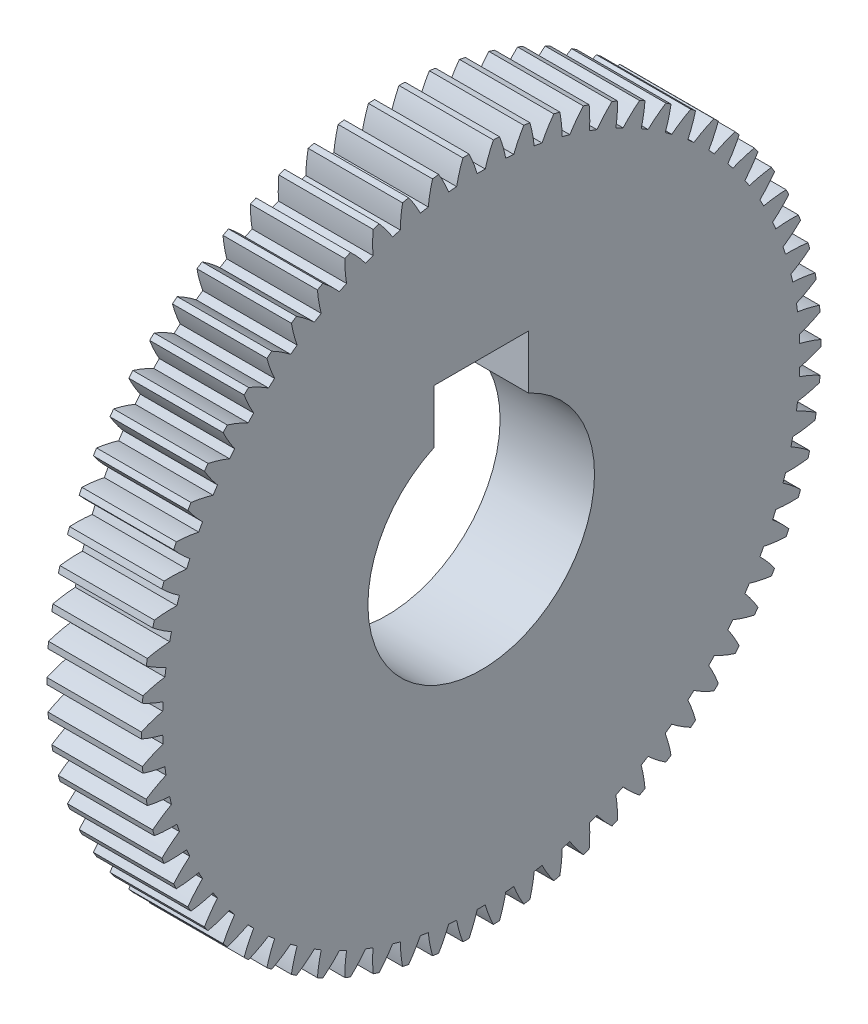
from build123d import *

# Parameters (mm, degrees)
BASPROSKE_W     = 5
BASPROSKE_H     = 18
TOOTHCUT_DEPTH  = 26.942243542
TEETHCUTS_COUNT = 70
TEETHCUTS_ANGLE = 354.857142857
BORSKE_R        = 6
BORE_DEPTH      = 50.0000508
KEYSKE_W        = 5
KEYSKE_H        = 8.3
KEYWAY_DEPTH    = 50.0000508


with BuildPart() as part:
    # BasProSke → Base-Revolve (revolve)
    with BuildSketch(Plane(origin=(0, 0, 0), x_dir=(1, 0, 0), z_dir=(0, 1, 0)), mode=Mode.PRIVATE) as base_revolve_sk:
        with Locations((2.5, 9)):
            Rectangle(BASPROSKE_W, BASPROSKE_H)
    revolve(base_revolve_sk.sketch.rotate(Axis((-10, 0, 0), (1, 0, 0)), 180), axis=Axis((-10, 0, 0), (1, 0, 0)))

    # TooCutSke → ToothCut (cut, through all)
    with BuildSketch(Plane(origin=(0, 0, 0), x_dir=(0, 0, -1), z_dir=(1, 0, 0))):
        with BuildLine():
            ThreePointArc((0.21220331, 16.872665639), (0, 16.874), (-0.21220331, 16.872665639))
            ThreePointArc((-0.21220331, 16.872665639), (-0.409386856, 17.452785162), (-0.656544674, 18.013439268))
            ThreePointArc((-0.656544674, 18.013439268), (0, 18.0254), (0.656544674, 18.013439268))
            ThreePointArc((0.656544674, 18.013439268), (0.409386856, 17.452785162), (0.21220331, 16.872665639))
        make_face()
    toothcut = extrude(amount=TOOTHCUT_DEPTH, mode=Mode.SUBTRACT)

    # TeethCuts: ToothCut ×70 about axis
    teethcuts_axis = Axis((-10, 0, 0), (1, 0, 0))
    for i in range(1, TEETHCUTS_COUNT):
        add(toothcut.rotate(teethcuts_axis, i * TEETHCUTS_ANGLE / (TEETHCUTS_COUNT - 1)), mode=Mode.SUBTRACT)

    # BorSke → Bore (cut, symmetric)
    with BuildSketch(Plane(origin=(0, 0, 0), x_dir=(0, 0, -1), z_dir=(1, 0, 0))):
        with Locations(Location((0, 0, 0), (0, 0, 180))):
            Circle(BORSKE_R)
    extrude(amount=BORE_DEPTH, both=True, mode=Mode.SUBTRACT)

    # KeySke → Keyway (cut, symmetric)
    with BuildSketch(Plane(origin=(0, 0, 0), x_dir=(0, 0, -1), z_dir=(1, 0, 0))):
        with Locations((0, 4.15)):
            Rectangle(KEYSKE_W, KEYSKE_H)
    extrude(amount=KEYWAY_DEPTH, both=True, mode=Mode.SUBTRACT)


solid = part.part
